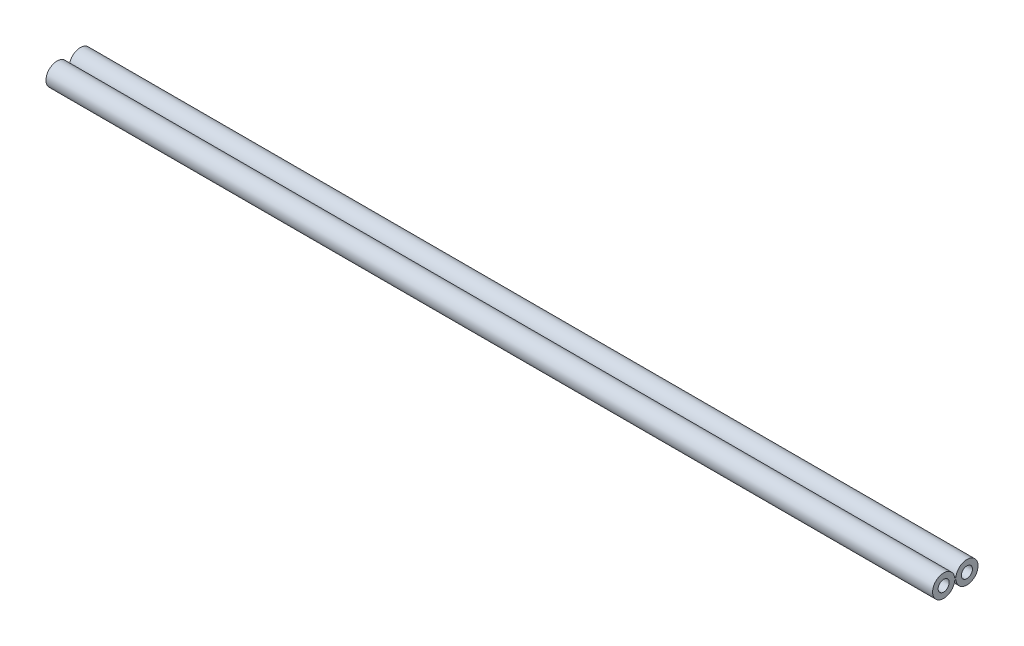
from build123d import *
from build123d.topology import SkipClean

# Parameters (mm, degrees)
SKETCH3_R               = 3.175
SKETCH3_R_2             = 1.5875
BOSS_EXTRUDE1_DEPTH     = 127
LPATTERN1_COUNT         = 2
LPATTERN1_PITCH         = 6.6675
BOSS_EXTRUDE2_DEPTH     = 127
CUT_EXTRUDE1_DEPTH      = 128.223842042
CUT_EXTRUDE1_DEPTH_BACK = 128.223842042


with BuildPart() as part:
    # Sketch3 → Boss-Extrude1 (new, symmetric)
    with BuildSketch(Plane(origin=(0, 0, 0), x_dir=(0, 0, -1), z_dir=(1, 0, 0))):
        with Locations((3.33375, 0)):
            Circle(SKETCH3_R)
        with Locations((3.33375, 0)):
            Circle(SKETCH3_R_2, mode=Mode.SUBTRACT)
    extrude(amount=BOSS_EXTRUDE1_DEPTH, both=True)


with BuildPart() as lpattern1_1:
    # LPattern1: pattern copy
    add(part.part.moved(Location(Vector(0, 0, 1) * (1 * LPATTERN1_PITCH))))


with BuildPart() as part_1:
    add(part.part)

    add(lpattern1_1.part)  # Boss-Extrude2 merges LPattern1_1
    # Sketch4 → Boss-Extrude2 (add, symmetric)
    with BuildSketch(Plane(origin=(0, 0, 0), x_dir=(0, 0, -1), z_dir=(1, 0, 0))):
        with BuildLine():
            Line((6.588125, 0.238125), (6.746875, 0.238125))
            ThreePointArc((6.746875, 0.238125), (6.811551474, 0.262993637), (6.842905738, 0.324786885))
            Line((6.842905738, 0.324786885), (6.842905738, -0.324786885))
            ThreePointArc((6.842905738, -0.324786885), (6.811551474, -0.262993637), (6.746875, -0.238125))
            Line((6.746875, -0.238125), (6.588125, -0.238125))
            ThreePointArc((6.588125, -0.238125), (6.523448526, -0.262993637), (6.492094262, -0.324786885))
            Line((6.492094262, -0.324786885), (6.492094262, 0.324786885))
            ThreePointArc((6.492094262, 0.324786885), (6.523448526, 0.262993637), (6.588125, 0.238125))
        make_face()
        with BuildLine():
            Line((0.175405738, 0.324786885), (0.175405738, -0.324786885))
            ThreePointArc((0.175405738, -0.324786885), (0.144051474, -0.262993637), (0.079375, -0.238125))
            Line((0.079375, -0.238125), (-0.079375, -0.238125))
            ThreePointArc((-0.079375, -0.238125), (-0.144051474, -0.262993637), (-0.175405738, -0.324786885))
            Line((-0.175405738, -0.324786885), (-0.175405738, 0.324786885))
            ThreePointArc((-0.175405738, 0.324786885), (-0.144051474, 0.262993637), (-0.079375, 0.238125))
            Line((-0.079375, 0.238125), (0.079375, 0.238125))
            ThreePointArc((0.079375, 0.238125), (0.144051474, 0.262993637), (0.175405738, 0.324786885))
        make_face()
    extrude(amount=BOSS_EXTRUDE2_DEPTH, both=True)

    # Sketch5 → Cut-Extrude1 (cut, two sides: drawn at the far end of the back side and taken through both)
    with SkipClean():  # the faces are left unmerged after this step: merging them gives an invalid solid
        with BuildSketch(Plane(origin=(0, 0, 0), x_dir=(0, 0, -1), z_dir=(1, 0, 0)).offset(-CUT_EXTRUDE1_DEPTH_BACK)):
            with BuildLine():
                Line((6.492094262, 0.324786885), (6.842905738, 0.324786885))
                Line((6.842905738, 0.324786885), (6.842905738, -0.324786885))
                Line((6.842905738, -0.324786885), (6.492094262, -0.324786885))
                ThreePointArc((6.492094262, -0.324786885), (6.50875, 0), (6.492094262, 0.324786885))
            make_face()
        extrude(amount=CUT_EXTRUDE1_DEPTH + CUT_EXTRUDE1_DEPTH_BACK, mode=Mode.SUBTRACT)


solid = part_1.part
